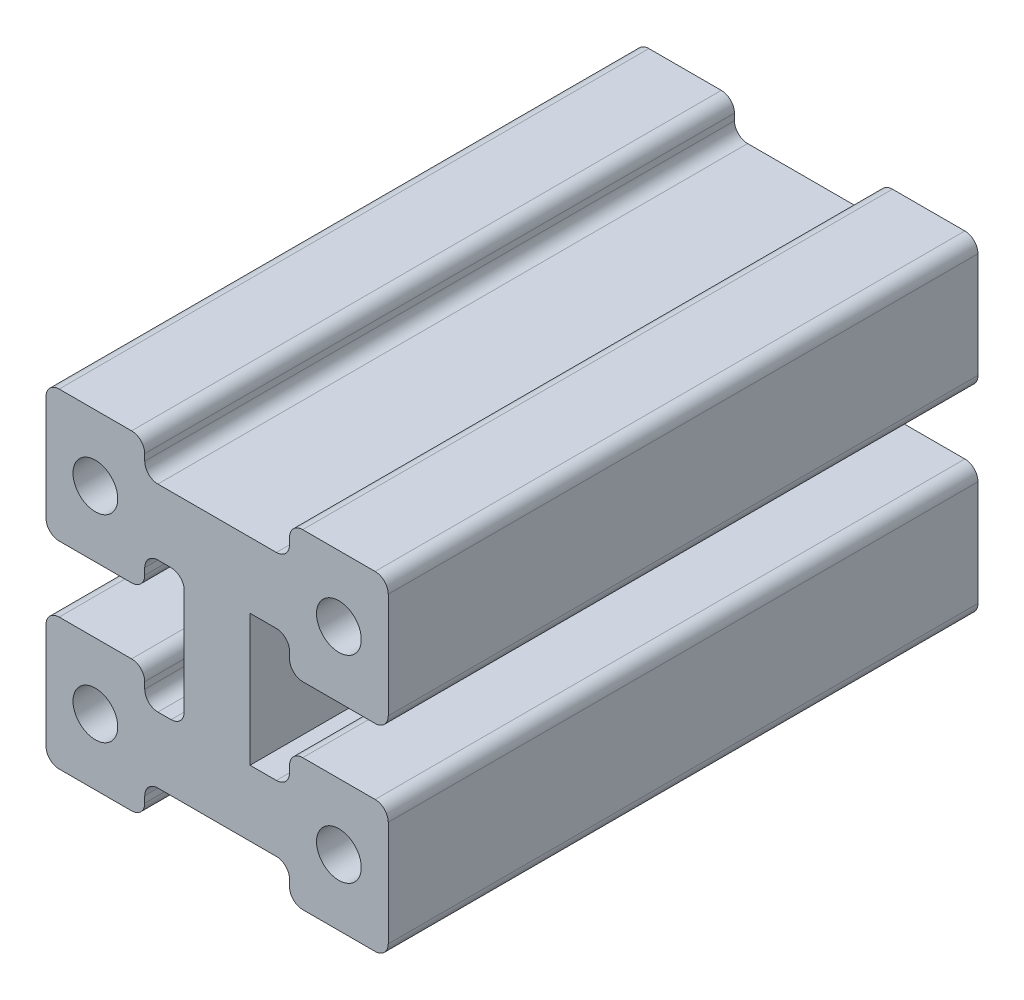
from build123d import *

# Parameters (mm, degrees)
SALIENTE_EXTRUIR1_DEPTH      = 22.4
REDONDEO1_R                  = 1
TALADRO_DE_MARGEN_PARA_M31_D = 3.4


with BuildPart() as part:
    # Croquis1 → Saliente-Extruir1 (new, symmetric)
    with BuildSketch(Plane(origin=(0, 0, 0), x_dir=(0, 1, 0), z_dir=(0, 0, 1))):
        Polygon((-5, 13), (5, 13), (5, 5.5), (2.5, 5.5), (2.5, 2.5), (12.5, 2.5), (12.5, 5.5), (10, 5.5), (10, 13), (20, 13), (20, 5.5), (17.5, 5.5), (17.5, -5.5), (20, -5.5), (20, -13), (10, -13), (10, -5.5), (12.5, -5.5), (12.5, -2.5), (2.5, -2.5), (2.5, -5.5), (5, -5.5), (5, -13), (-5, -13), (-5, -5.5), (-2.5, -5.5), (-2.5, 5.5), (-5, 5.5), align=None)
    extrude(amount=SALIENTE_EXTRUIR1_DEPTH, both=True)

    # Redondeo1
    redondeo1_edges = [part.edges().sort_by_distance(p)[0] for p in [
        (-5.5, -5, 0),
        (-13, -5, 0),
        (-13, 5, 0),
        (-5.5, 5, 0),
        (-5.5, 2.5, 0),
        (-2.5, 2.5, 0),
        (-2.5, 12.5, 0),
        (-5.5, 12.5, 0),
        (-5.5, 10, 0),
        (-13, 10, 0),
        (-13, 20, 0),
        (-5.5, 20, 0),
        (-5.5, 17.5, 0),
        (5.5, 17.5, 0),
        (5.5, 20, 0),
        (13, 20, 0),
        (13, 10, 0),
        (5.5, 10, 0),
        (5.5, 12.5, 0),
        (5.5, 2.5, 0),
        (5.5, 5, 0),
        (13, 5, 0),
        (13, -5, 0),
        (5.5, -5, 0),
        (5.5, -2.5, 0),
        (-5.5, -2.5, 0),
    ]]
    fillet(redondeo1_edges, radius=REDONDEO1_R)

    # Taladro de margen para M31 (through all)
    with Locations(Plane(origin=(0, 0, -22.4), x_dir=(1, 0, 0), z_dir=(0, 0, -1))):
        with Locations((-9.25, -15), (-9.25, 0), (9.25, 0), (9.25, -15)):
            Hole(TALADRO_DE_MARGEN_PARA_M31_D / 2)


solid = part.part
